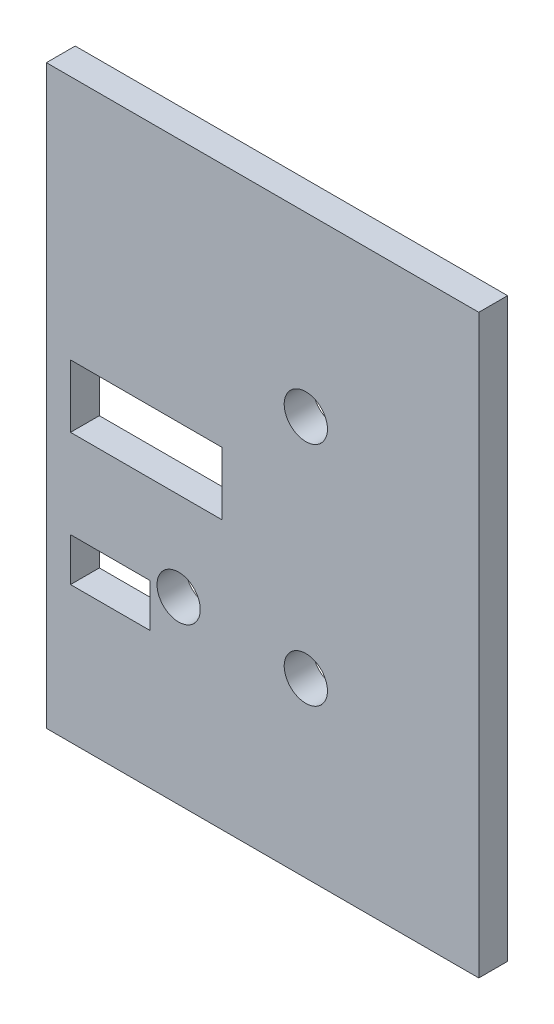
from build123d import *

# Parameters (mm, degrees)
SKETCH1_W           = 30
SKETCH1_H           = 40
BOSS_EXTRUDE1_DEPTH = 2
SKETCH2_R           = 1.5
SKETCH2_W           = 5.5
SKETCH2_H           = 3
SKETCH2_W_2         = 10.5
SKETCH2_H_2         = 4.353558907
CUT_EXTRUDE1_DEPTH  = 2
SKETCH3_R           = 1.5
CUT_EXTRUDE2_DEPTH  = 2


with BuildPart() as part:
    # Sketch1 → Boss-Extrude1 (new body)
    with BuildSketch(Plane.XY):
        Rectangle(SKETCH1_W, SKETCH1_H)
    extrude(amount=BOSS_EXTRUDE1_DEPTH)

    # Sketch2 → Cut-Extrude1 (cut)
    with BuildSketch(Plane.XY.offset(2)):
        with Locations((-5.825207061, -7.522713977)):
            Circle(SKETCH2_R)
        with Locations((-10.575207061, -9.022713977)):
            Rectangle(SKETCH2_W, SKETCH2_H)
        with Locations((-8.075207061, 0.800506569)):
            Rectangle(SKETCH2_W_2, SKETCH2_H_2)
    extrude(amount=-CUT_EXTRUDE1_DEPTH, mode=Mode.SUBTRACT)

    # Sketch3 → Cut-Extrude2 (cut)
    with BuildSketch(Plane.XY.offset(2)):
        with Locations((3, -8)):
            Circle(SKETCH3_R)
        with Locations((3, 7.73)):
            Circle(SKETCH3_R)
    extrude(amount=-CUT_EXTRUDE2_DEPTH, mode=Mode.SUBTRACT)


solid = part.part
